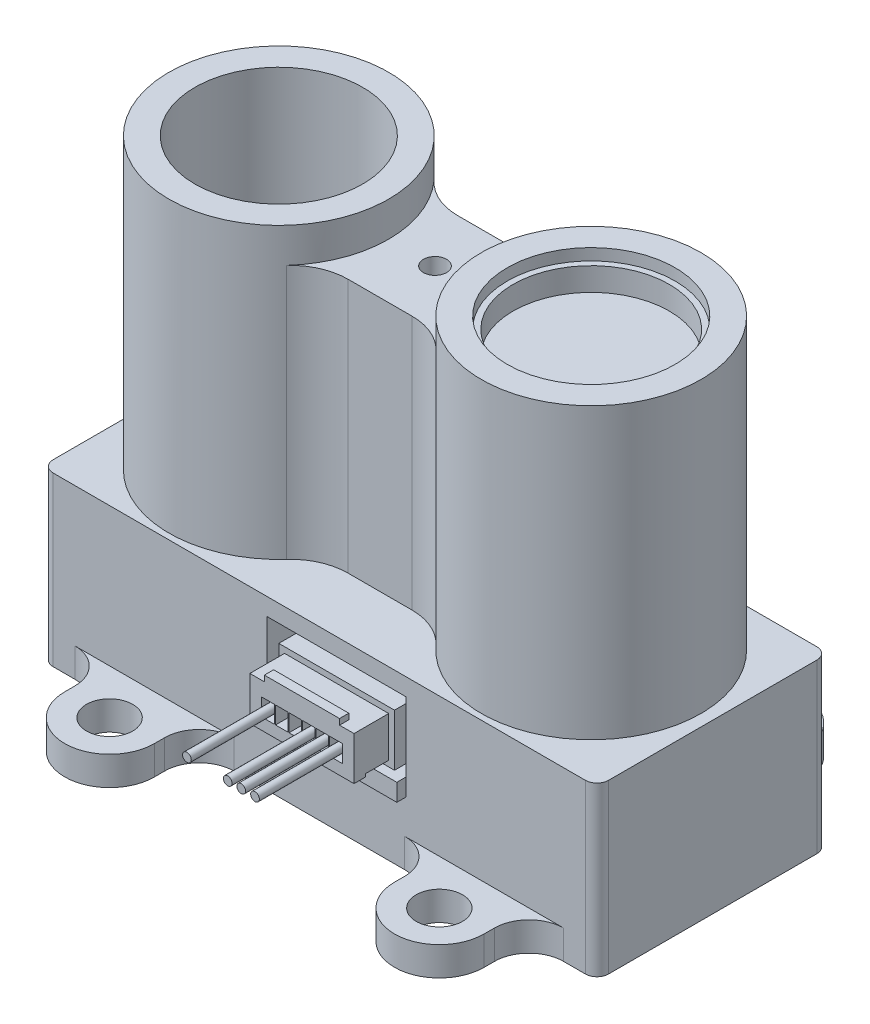
from build123d import *

# Parameters (mm, degrees)
SKETCH1_W               = 48
SKETCH1_H               = 20
BOSS_EXTRUDE1_DEPTH     = 14.5
FILLET1_R               = 1
SKETCH2_R               = 9.5
BOSS_EXTRUDE2_DEPTH     = 25
SKETCH3_W               = 10.545517328
SKETCH3_H               = 9.5
BOSS_EXTRUDE3_DEPTH     = 22
FILLET2_R               = 5
SKETCH4_R               = 1
CUT_EXTRUDE1_DEPTH      = 5
SKETCH5_R               = 7.25
CUT_EXTRUDE2_DEPTH      = 13
SKETCH6_W               = 0.5
SKETCH6_H               = 2
SKETCH8_R               = 7.25
CUT_EXTRUDE3_DEPTH      = 3
SKETCH9_W               = 0.5
SKETCH9_H               = 2
SKETCH11_W              = 9
SKETCH11_H              = 3.5
BOSS_EXTRUDE4_DEPTH     = 3
SKETCH12_W              = 6.5
SKETCH12_H              = 0.5
BOSS_EXTRUDE5_DEPTH     = 0.8
SKETCH13_W              = 9
SKETCH13_H              = 0.25
BOSS_EXTRUDE6_DEPTH     = 1
SKETCH14_W              = 12
SKETCH14_H              = 1.5
BOSS_EXTRUDE7_DEPTH     = 0.8
CUT_EXTRUDE4_DEPTH      = 5
SKETCH16_W              = 7.75
SKETCH16_H              = 7.75
SKETCH16_R              = 2
BOSS_EXTRUDE8_DEPTH     = 2.5
MIRROR4_COPY_1_SKETCH_W = 7.75
MIRROR4_COPY_1_SKETCH_H = 7.75
MIRROR4_COPY_1_SKETCH_R = 2
MIRROR4_COPY_1_DEPTH    = 2.5
FILLET3_RADIUS          = 3.875
FILLET3_LENGTH          = 2.5
FILLET5_RADIUS          = 3.875
FILLET5_LENGTH          = 2.5
FILLET6_RADIUS          = 3.875
FILLET6_LENGTH          = 2.5
FILLET7_RADIUS          = 3.875
FILLET7_LENGTH          = 2.5
FILLET4_R               = 3
SKETCH17_W              = 7
SKETCH17_H              = 1.5
CUT_EXTRUDE5_DEPTH      = 3
SKETCH18_W              = 0.1
SKETCH18_H              = 1.5
BOSS_EXTRUDE9_DEPTH     = 3
SKETCH19_R              = 0.375
BOSS_EXTRUDE10_DEPTH    = 10


with BuildPart() as part:
    # Sketch1 → Boss-Extrude1 (new body)
    with BuildSketch(Plane(origin=(0, 0, 0), x_dir=(1, 0, 0), z_dir=(0, 1, 0))):
        Rectangle(SKETCH1_W, SKETCH1_H)
    extrude(amount=BOSS_EXTRUDE1_DEPTH)

    # Fillet1
    fillet1_edges = [part.edges().sort_by_distance(p)[0] for p in [
        (-24, 7.25, -10),
        (24, 7.25, -10),
        (24, 7.25, 10),
        (-24, 7.25, 10),
    ]]
    fillet(fillet1_edges, radius=FILLET1_R)

    # Sketch2 → Boss-Extrude2 (add)
    with BuildSketch(Plane(origin=(0, 14.5, 0), x_dir=(1, 0, 0), z_dir=(0, 1, 0))):
        with Locations(Location((-13.5, 0, 0), (0, 0, 270))):
            Circle(SKETCH2_R)
        with Locations(Location((13.5, 0, 0), (0, 0, 90))):
            Circle(SKETCH2_R)
    extrude(amount=BOSS_EXTRUDE2_DEPTH)

    # Sketch3 → Boss-Extrude3 (add)
    with BuildSketch(Plane(origin=(0, 14.5, 0), x_dir=(1, 0, 0), z_dir=(0, 1, 0))):
        Rectangle(SKETCH3_W, SKETCH3_H)
    extrude(amount=BOSS_EXTRUDE3_DEPTH)

    # Fillet2
    fillet2_edges = [part.edges().sort_by_distance(p)[0] for p in [
        (-5.272758664, 25.5, -4.75),
        (-5.272758664, 25.5, 4.75),
        (5.272758664, 25.5, 4.75),
        (5.272758664, 25.5, -4.75),
    ]]
    fillet(fillet2_edges, radius=FILLET2_R)

    # Sketch4 → Cut-Extrude1 (cut)
    with BuildSketch(Plane(origin=(0, 36.5, 0), x_dir=(1, 0, 0), z_dir=(0, 1, 0))):
        with Locations(Location((0, 0, 0), (0, 0, 270))):
            Circle(SKETCH4_R)
    extrude(amount=-CUT_EXTRUDE1_DEPTH, mode=Mode.SUBTRACT)

    # Sketch5 → Cut-Extrude2 (cut)
    with BuildSketch(Plane(origin=(0, 39.5, 0), x_dir=(1, 0, 0), z_dir=(0, 1, 0))):
        with Locations(Location((-13.5, 0, 0), (0, 0, 270))):
            Circle(SKETCH5_R)
    extrude(amount=-CUT_EXTRUDE2_DEPTH, mode=Mode.SUBTRACT)

    # Sketch6 → Revolve1 (revolve)
    with BuildSketch(Plane.XY, mode=Mode.PRIVATE) as revolve1_sk:
        with Locations((-20.5, 27.5)):
            Rectangle(SKETCH6_W, SKETCH6_H)
    revolve(revolve1_sk.sketch.rotate(Axis((-13.5, 39.5, 0), (0, -1, 0)), 270), axis=Axis((-13.5, 39.5, 0), (0, -1, 0)))

    # Sketch7 → Revolve2 (revolve)
    with BuildSketch(Plane.XY, mode=Mode.PRIVATE) as revolve2_sk:
        with BuildLine():
            Line((-20.25, 26.5), (-13.5, 26.5))
            Line((-13.5, 26.5), (-13.5, 28.5))
            add(Edge.make_bspline(
                [(-13.5, 28.5), (-20.25, 28.5), (-20.25, 26.5)],
                knots=[4.71238898, 4.71238898, 4.71238898, 6.283185307, 6.283185307, 6.283185307], degree=2, weights=[1, 0.707106781, 1]))
        make_face()
    revolve(revolve2_sk.sketch.rotate(Axis((-13.5, 26.5, 0), (0, 1, 0)), 222.253636979), axis=Axis((-13.5, 26.5, 0), (0, 1, 0)))

    # Sketch8 → Cut-Extrude3 (cut)
    with BuildSketch(Plane(origin=(0, 39.5, 0), x_dir=(1, 0, 0), z_dir=(0, 1, 0))):
        with Locations(Location((13.5, 0, 0), (0, 0, 270))):
            Circle(SKETCH8_R)
    extrude(amount=-CUT_EXTRUDE3_DEPTH, mode=Mode.SUBTRACT)

    # Sketch9 → Revolve3 (revolve)
    with BuildSketch(Plane.XY, mode=Mode.PRIVATE) as revolve3_sk:
        with Locations((20.5, 37.5)):
            Rectangle(SKETCH9_W, SKETCH9_H)
    revolve(revolve3_sk.sketch.rotate(Axis((13.5, 36.5, 0), (0, 1, 0)), 270), axis=Axis((13.5, 36.5, 0), (0, 1, 0)))

    # Sketch11 → Boss-Extrude4 (add)
    with BuildSketch(Plane.XY.offset(10)):
        with Locations((1.5, 9.25)):
            Rectangle(SKETCH11_W, SKETCH11_H)
    extrude(amount=BOSS_EXTRUDE4_DEPTH)

    # Sketch12 → Boss-Extrude5 (add)
    with BuildSketch(Plane.XY.offset(13)):
        with Locations((1.5, 11.25)):
            Rectangle(SKETCH12_W, SKETCH12_H)
    extrude(amount=-BOSS_EXTRUDE5_DEPTH)

    # Sketch13 → Boss-Extrude6 (add)
    with BuildSketch(Plane.XY.offset(13)):
        with Locations((1.5, 7.375)):
            Rectangle(SKETCH13_W, SKETCH13_H)
    extrude(amount=-BOSS_EXTRUDE6_DEPTH)

    # Sketch14 → Boss-Extrude7 (add)
    with BuildSketch(Plane.XY.offset(10)):
        with Locations((1.5, 6.25)):
            Rectangle(SKETCH14_W, SKETCH14_H)
    extrude(amount=BOSS_EXTRUDE7_DEPTH)

    # Sketch15 → Cut-Extrude4 (cut)
    with BuildSketch(Plane.XY.offset(10)):
        Polygon((-4.5, 7), (-4.5, 13), (7.5, 13), (7.5, 7), (6.5, 7), (6.5, 11.5), (-3.5, 11.5), (-3.5, 7), align=None)
    extrude(amount=-CUT_EXTRUDE4_DEPTH, mode=Mode.SUBTRACT)

    # Sketch16 → Boss-Extrude8 (add)
    with BuildSketch(Plane.XZ):
        with Locations((-14.25, 13.875)):
            Rectangle(SKETCH16_W, SKETCH16_H)
        with Locations(Location((-14.25, 13.875, 0), (0, 0, 270))):
            Circle(SKETCH16_R, mode=Mode.SUBTRACT)
    boss_extrude8 = extrude(amount=-BOSS_EXTRUDE8_DEPTH)

    # Mirror3: Boss-Extrude8 across plane
    add(boss_extrude8.mirror(Plane.XY))

    # Mirror4: Boss-Extrude8 across plane
    add(boss_extrude8.mirror(Plane(origin=(0, 0, 0), x_dir=(0, 0, 1), z_dir=(1, 0, 0))))

    # Mirror4 copy 1 sketch → Mirror4 copy 1 (add)
    with BuildSketch(Plane(origin=(0, 0, 0), x_dir=(-1, 0, 0), z_dir=(0, -1, 0))):
        with Locations((-14.25, 13.875)):
            Rectangle(MIRROR4_COPY_1_SKETCH_W, MIRROR4_COPY_1_SKETCH_H)
        with Locations(Location((-14.25, 13.875, 0), (0, 0, 270))):
            Circle(MIRROR4_COPY_1_SKETCH_R, mode=Mode.SUBTRACT)
    extrude(amount=-MIRROR4_COPY_1_DEPTH)

    # Fillet3: full round fillet: the end face becomes a half cylinder, R = half its width
    fillet3_face = Plane((-14.25, 1.25, 17.75), x_dir=(0, -1, 0), z_dir=(0, 0, 1))  # on the end face: x along it, z out of the body
    fillet3_slab = fillet3_face.offset(-FILLET3_RADIUS / 2) * Box(FILLET3_LENGTH, 2 * FILLET3_RADIUS, FILLET3_RADIUS, mode=Mode.PRIVATE)  # the body's end, R deep
    fillet3_round = Plane((-14.25, 1.25, 13.875), x_dir=(0, 0, 1), z_dir=(0, -1, 0)) * Cylinder(FILLET3_RADIUS, FILLET3_LENGTH, mode=Mode.PRIVATE)  # its axis R under the face
    add(fillet3_slab - fillet3_round, mode=Mode.SUBTRACT)

    # Fillet5: full round fillet: the end face becomes a half cylinder, R = half its width
    fillet5_face = Plane((14.25, 1.25, 17.75), x_dir=(0, 1, 0), z_dir=(0, 0, 1))  # on the end face: x along it, z out of the body
    fillet5_slab = fillet5_face.offset(-FILLET5_RADIUS / 2) * Box(FILLET5_LENGTH, 2 * FILLET5_RADIUS, FILLET5_RADIUS, mode=Mode.PRIVATE)  # the body's end, R deep
    fillet5_round = Plane((14.25, 1.25, 13.875), x_dir=(0, 0, 1), z_dir=(0, 1, 0)) * Cylinder(FILLET5_RADIUS, FILLET5_LENGTH, mode=Mode.PRIVATE)  # its axis R under the face
    add(fillet5_slab - fillet5_round, mode=Mode.SUBTRACT)

    # Fillet6: full round fillet: the end face becomes a half cylinder, R = half its width
    fillet6_face = Plane((-14.25, 1.25, -17.75), x_dir=(0, 1, 0), z_dir=(0, 0, -1))  # on the end face: x along it, z out of the body
    fillet6_slab = fillet6_face.offset(-FILLET6_RADIUS / 2) * Box(FILLET6_LENGTH, 2 * FILLET6_RADIUS, FILLET6_RADIUS, mode=Mode.PRIVATE)  # the body's end, R deep
    fillet6_round = Plane((-14.25, 1.25, -13.875), x_dir=(0, 0, -1), z_dir=(0, 1, 0)) * Cylinder(FILLET6_RADIUS, FILLET6_LENGTH, mode=Mode.PRIVATE)  # its axis R under the face
    add(fillet6_slab - fillet6_round, mode=Mode.SUBTRACT)

    # Fillet7: full round fillet: the end face becomes a half cylinder, R = half its width
    fillet7_face = Plane((14.25, 1.25, -17.75), x_dir=(0, -1, 0), z_dir=(0, 0, -1))  # on the end face: x along it, z out of the body
    fillet7_slab = fillet7_face.offset(-FILLET7_RADIUS / 2) * Box(FILLET7_LENGTH, 2 * FILLET7_RADIUS, FILLET7_RADIUS, mode=Mode.PRIVATE)  # the body's end, R deep
    fillet7_round = Plane((14.25, 1.25, -13.875), x_dir=(0, 0, -1), z_dir=(0, -1, 0)) * Cylinder(FILLET7_RADIUS, FILLET7_LENGTH, mode=Mode.PRIVATE)  # its axis R under the face
    add(fillet7_slab - fillet7_round, mode=Mode.SUBTRACT)

    # Fillet4
    fillet4_edges = [part.edges().sort_by_distance(p)[0] for p in [
        (-18.125, 1.25, 10),
        (-10.375, 1.25, 10),
        (-18.125, 1.25, -10),
        (-10.375, 1.25, -10),
        (18.125, 1.25, 10),
        (10.375, 1.25, 10),
        (18.125, 1.25, -10),
        (10.375, 1.25, -10),
    ]]
    fillet(fillet4_edges, radius=FILLET4_R)

    # Sketch17 → Cut-Extrude5 (cut)
    with BuildSketch(Plane.XY.offset(13)):
        with Locations((1.5, 9)):
            Rectangle(SKETCH17_W, SKETCH17_H)
    extrude(amount=-CUT_EXTRUDE5_DEPTH, mode=Mode.SUBTRACT)

    # Sketch18 → Boss-Extrude9 (add)
    with BuildSketch(Plane.XY.offset(10)):
        with Locations((-0.833333333, 9)):
            Rectangle(SKETCH18_W, SKETCH18_H)
        with Locations((0.333333333, 9)):
            Rectangle(SKETCH18_W, SKETCH18_H)
        with Locations((1.5, 9)):
            Rectangle(SKETCH18_W, SKETCH18_H)
        with Locations((2.666666667, 9)):
            Rectangle(SKETCH18_W, SKETCH18_H)
        with Locations((3.833333333, 9)):
            Rectangle(SKETCH18_W, SKETCH18_H)
    extrude(amount=BOSS_EXTRUDE9_DEPTH)

    # Sketch19 → Boss-Extrude10 (add)
    with BuildSketch(Plane.XY.offset(10)):
        with Locations((-1.441666667, 9)):
            Circle(SKETCH19_R)
        with Locations((2.083333333, 9)):
            Circle(SKETCH19_R)
        with Locations((3.25, 9)):
            Circle(SKETCH19_R)
        with Locations((4.441666667, 9)):
            Circle(SKETCH19_R)
    extrude(amount=BOSS_EXTRUDE10_DEPTH)


solid = part.part
